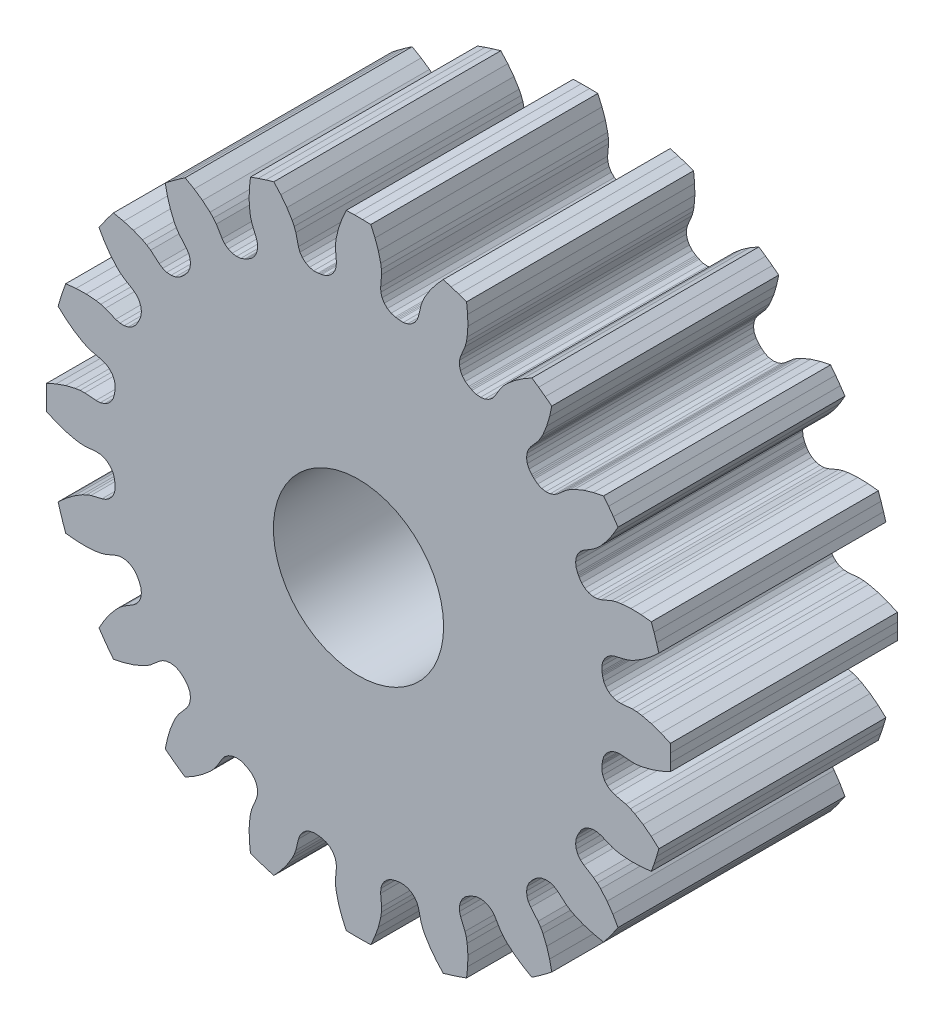
from build123d import *

# Parameters (mm, degrees)
EXTRUDE_1_DEPTH = 4.00000019
SKETCH_2_R      = 1.75
SKETCH_2_R_2    = 1.5
EXTRUDE_2_DEPTH = 4.00000019


with BuildPart() as part:
    # Эскиз1 → Бобышка-Вытянуть1 (new body)
    with BuildSketch(Plane.XY.offset(4.00000019)):
        Polygon((4.321288317, -0.574795646), (4.359403625, -0.509059406), (4.412631039, -0.454829365), (4.477644339, -0.415493647), (4.550382029, -0.393509952), (4.626299255, -0.390251807), (4.823635798, -0.406552339), (4.907172639, -0.403153826), (4.991217051, -0.391086418), (5.159787834, -0.35000444), (5.328199361, -0.290927448), (5.495740566, -0.216414497), (5.499526393, -0.072154726), (5.499526393, 0.072154726), (5.495740566, 0.216414497), (5.328199361, 0.290927448), (5.159787834, 0.35000444), (4.991217051, 0.391086418), (4.907172639, 0.403153826), (4.823635798, 0.406552339), (4.626299255, 0.390251807), (4.550382029, 0.393509952), (4.477644339, 0.415493647), (4.412631039, 0.454829365), (4.359403625, 0.509059406), (4.321288317, 0.574795646), (4.300666042, 0.647930894), (4.29735193, 0.669557718), (4.29392932, 0.691167545), (4.29039821, 0.712759851), (4.287410527, 0.78868831), (4.303347319, 0.862985558), (4.337211605, 0.931009534), (4.38688742, 0.988510321), (4.449271597, 1.031895168), (4.520467017, 1.058453578), (4.713181872, 1.103931223), (4.791580141, 1.132977777), (4.867781419, 1.170425559), (5.015407223, 1.26158807), (5.157320295, 1.369815785), (5.293635651, 1.492454787), (5.252657924, 1.630823943), (5.208063405, 1.768070506), (5.15988376, 1.904099714), (4.977517761, 1.923192642), (4.799092188, 1.927336096), (4.626077134, 1.914316206), (4.542416893, 1.899821917), (4.461918958, 1.877239672), (4.279277753, 1.800756669), (4.206069279, 1.780395629), (4.130098503, 1.778826118), (4.056111444, 1.796146389), (3.988731187, 1.83127413), (3.93216731, 1.88201468), (3.889954649, 1.945197699), (3.880119883, 1.964741852), (3.870186862, 1.984236529), (3.860156052, 2.003680682), (3.83385201, 2.074969932), (3.826049389, 2.150555374), (3.837235505, 2.225714736), (3.866711631, 2.295752056), (3.912635613, 2.356291283), (3.97213921, 2.403550083), (4.141368903, 2.506354125), (4.206954036, 2.558205277), (4.26785415, 2.617368242), (4.380083643, 2.749687759), (4.481607117, 2.89647188), (4.573352635, 3.055232344), (4.491622094, 3.174166195), (4.406798631, 3.29091493), (4.31894185, 3.405398456), (4.139601253, 3.367202356), (3.968628589, 3.316006623), (3.808104433, 3.250159323), (3.73301818, 3.210522234), (3.663437907, 3.164169844), (3.513370408, 3.034990747), (3.45003698, 2.993003931), (3.378269495, 2.968034707), (3.302551573, 2.961644204), (3.227614099, 2.974231029), (3.158139298, 3.005008912), (3.098467365, 3.052055137), (3.083074465, 3.067603568), (3.067603568, 3.083074465), (3.052055137, 3.098467365), (3.005008912, 3.158139298), (2.974231029, 3.227614099), (2.961644204, 3.302551573), (2.968034707, 3.378269495), (2.993003931, 3.45003698), (3.034990747, 3.513370408), (3.164169844, 3.663437907), (3.210522234, 3.73301818), (3.250159323, 3.808104433), (3.316006623, 3.968628589), (3.367202356, 4.139601253), (3.405398456, 4.31894185), (3.29091493, 4.406798631), (3.174166195, 4.491622094), (3.055232344, 4.573352635), (2.89647188, 4.481607117), (2.749687759, 4.380083643), (2.617368242, 4.26785415), (2.558205277, 4.206954036), (2.506354125, 4.141368903), (2.403550083, 3.97213921), (2.356291283, 3.912635613), (2.295752056, 3.866711631), (2.225714736, 3.837235505), (2.150555374, 3.826049389), (2.074969932, 3.83385201), (2.003680682, 3.860156052), (1.984236529, 3.870186862), (1.964741852, 3.880119883), (1.945197699, 3.889954649), (1.88201468, 3.93216731), (1.83127413, 3.988731187), (1.796146389, 4.056111444), (1.778826118, 4.130098503), (1.780395629, 4.206069279), (1.800756669, 4.279277753), (1.877239672, 4.461918958), (1.899821917, 4.542416893), (1.914316206, 4.626077134), (1.927336096, 4.799092188), (1.923192642, 4.977517761), (1.904099714, 5.15988376), (1.768070506, 5.208063405), (1.630823943, 5.252657924), (1.492454787, 5.293635651), (1.369815785, 5.157320295), (1.26158807, 5.015407223), (1.170425559, 4.867781419), (1.132977777, 4.791580141), (1.103931223, 4.713181872), (1.058453578, 4.520467017), (1.031895168, 4.449271597), (0.988510321, 4.38688742), (0.931009534, 4.337211605), (0.862985558, 4.303347319), (0.78868831, 4.287410527), (0.712759851, 4.29039821), (0.691167545, 4.29392932), (0.669557718, 4.29735193), (0.647930894, 4.300666042), (0.574795646, 4.321288317), (0.509059406, 4.359403625), (0.454829365, 4.412631039), (0.415493647, 4.477644339), (0.393509952, 4.550382029), (0.390251807, 4.626299255), (0.406552339, 4.823635798), (0.403153826, 4.907172639), (0.391086418, 4.991217051), (0.35000444, 5.159787834), (0.290927448, 5.328199361), (0.216414497, 5.495740566), (0.072154726, 5.499526393), (-0.072154726, 5.499526393), (-0.216414497, 5.495740566), (-0.290927448, 5.328199361), (-0.35000444, 5.159787834), (-0.391086418, 4.991217051), (-0.403153826, 4.907172639), (-0.406552339, 4.823635798), (-0.390251807, 4.626299255), (-0.393509952, 4.550382029), (-0.415493647, 4.477644339), (-0.454829365, 4.412631039), (-0.509059406, 4.359403625), (-0.574795646, 4.321288317), (-0.647930894, 4.300666042), (-0.669557718, 4.29735193), (-0.691167545, 4.29392932), (-0.712759851, 4.29039821), (-0.78868831, 4.287410527), (-0.862985558, 4.303347319), (-0.931009534, 4.337211605), (-0.988510321, 4.38688742), (-1.031895168, 4.449271597), (-1.058453578, 4.520467017), (-1.103931223, 4.713181872), (-1.132977777, 4.791580141), (-1.170425559, 4.867781419), (-1.26158807, 5.015407223), (-1.369815785, 5.157320295), (-1.492454787, 5.293635651), (-1.630823943, 5.252657924), (-1.768070506, 5.208063405), (-1.904099714, 5.15988376), (-1.923192642, 4.977517761), (-1.927336096, 4.799092188), (-1.914316206, 4.626077134), (-1.899821917, 4.542416893), (-1.877239672, 4.461918958), (-1.800756669, 4.279277753), (-1.780395629, 4.206069279), (-1.778826118, 4.130098503), (-1.796146389, 4.056111444), (-1.83127413, 3.988731187), (-1.88201468, 3.93216731), (-1.945197699, 3.889954649), (-1.964741852, 3.880119883), (-1.984236529, 3.870186862), (-2.003680682, 3.860156052), (-2.074969932, 3.83385201), (-2.150555374, 3.826049389), (-2.225714736, 3.837235505), (-2.295752056, 3.866711631), (-2.356291283, 3.912635613), (-2.403550083, 3.97213921), (-2.506354125, 4.141368903), (-2.558205277, 4.206954036), (-2.617368242, 4.26785415), (-2.749687759, 4.380083643), (-2.89647188, 4.481607117), (-3.055232344, 4.573352635), (-3.174166195, 4.491622094), (-3.29091493, 4.406798631), (-3.405398456, 4.31894185), (-3.367202356, 4.139601253), (-3.316006623, 3.968628589), (-3.250159323, 3.808104433), (-3.210522234, 3.73301818), (-3.164169844, 3.663437907), (-3.034990747, 3.513370408), (-2.993003931, 3.45003698), (-2.968034707, 3.378269495), (-2.961644204, 3.302551573), (-2.974231029, 3.227614099), (-3.005008912, 3.158139298), (-3.052055137, 3.098467365), (-3.067603568, 3.083074465), (-3.083074465, 3.067603568), (-3.098467365, 3.052055137), (-3.158139298, 3.005008912), (-3.227614099, 2.974231029), (-3.302551573, 2.961644204), (-3.378269495, 2.968034707), (-3.45003698, 2.993003931), (-3.513370408, 3.034990747), (-3.663437907, 3.164169844), (-3.73301818, 3.210522234), (-3.808104433, 3.250159323), (-3.968628589, 3.316006623), (-4.139601253, 3.367202356), (-4.31894185, 3.405398456), (-4.406798631, 3.29091493), (-4.491622094, 3.174166195), (-4.573352635, 3.055232344), (-4.481607117, 2.89647188), (-4.380083643, 2.749687759), (-4.26785415, 2.617368242), (-4.206954036, 2.558205277), (-4.141368903, 2.506354125), (-3.97213921, 2.403550083), (-3.912635613, 2.356291283), (-3.866711631, 2.295752056), (-3.837235505, 2.225714736), (-3.826049389, 2.150555374), (-3.83385201, 2.074969932), (-3.860156052, 2.003680682), (-3.870186862, 1.984236529), (-3.880119883, 1.964741852), (-3.889954649, 1.945197699), (-3.93216731, 1.88201468), (-3.988731187, 1.83127413), (-4.056111444, 1.796146389), (-4.130098503, 1.778826118), (-4.206069279, 1.780395629), (-4.279277753, 1.800756669), (-4.461918958, 1.877239672), (-4.542416893, 1.899821917), (-4.626077134, 1.914316206), (-4.799092188, 1.927336096), (-4.977517761, 1.923192642), (-5.15988376, 1.904099714), (-5.208063405, 1.768070506), (-5.252657924, 1.630823943), (-5.293635651, 1.492454787), (-5.157320295, 1.369815785), (-5.015407223, 1.26158807), (-4.867781419, 1.170425559), (-4.791580141, 1.132977777), (-4.713181872, 1.103931223), (-4.520467017, 1.058453578), (-4.449271597, 1.031895168), (-4.38688742, 0.988510321), (-4.337211605, 0.931009534), (-4.303347319, 0.862985558), (-4.287410527, 0.78868831), (-4.29039821, 0.712759851), (-4.29392932, 0.691167545), (-4.29735193, 0.669557718), (-4.300666042, 0.647930894), (-4.321288317, 0.574795646), (-4.359403625, 0.509059406), (-4.412631039, 0.454829365), (-4.477644339, 0.415493647), (-4.550382029, 0.393509952), (-4.626299255, 0.390251807), (-4.823635798, 0.406552339), (-4.907172639, 0.403153826), (-4.991217051, 0.391086418), (-5.159787834, 0.35000444), (-5.328199361, 0.290927448), (-5.495740566, 0.216414497), (-5.499526393, 0.072154726), (-5.499526393, -0.072154726), (-5.495740566, -0.216414497), (-5.328199361, -0.290927448), (-5.159787834, -0.35000444), (-4.991217051, -0.391086418), (-4.907172639, -0.403153826), (-4.823635798, -0.406552339), (-4.626299255, -0.390251807), (-4.550382029, -0.393509952), (-4.477644339, -0.415493647), (-4.412631039, -0.454829365), (-4.359403625, -0.509059406), (-4.321288317, -0.574795646), (-4.300666042, -0.647930894), (-4.29735193, -0.669557718), (-4.29392932, -0.691167545), (-4.29039821, -0.712759851), (-4.287410527, -0.78868831), (-4.303347319, -0.862985558), (-4.337211605, -0.931009534), (-4.38688742, -0.988510321), (-4.449271597, -1.031895168), (-4.520467017, -1.058453578), (-4.713181872, -1.103931223), (-4.791580141, -1.132977777), (-4.867781419, -1.170425559), (-5.015407223, -1.26158807), (-5.157320295, -1.369815785), (-5.293635651, -1.492454787), (-5.252657924, -1.630823943), (-5.208063405, -1.768070506), (-5.15988376, -1.904099714), (-4.977517761, -1.923192642), (-4.799092188, -1.927336096), (-4.626077134, -1.914316206), (-4.542416893, -1.899821917), (-4.461918958, -1.877239672), (-4.279277753, -1.800756669), (-4.206069279, -1.780395629), (-4.130098503, -1.778826118), (-4.056111444, -1.796146389), (-3.988731187, -1.83127413), (-3.93216731, -1.88201468), (-3.889954649, -1.945197699), (-3.880119883, -1.964741852), (-3.870186862, -1.984236529), (-3.860156052, -2.003680682), (-3.83385201, -2.074969932), (-3.826049389, -2.150555374), (-3.837235505, -2.225714736), (-3.866711631, -2.295752056), (-3.912635613, -2.356291283), (-3.97213921, -2.403550083), (-4.141368903, -2.506354125), (-4.206954036, -2.558205277), (-4.26785415, -2.617368242), (-4.380083643, -2.749687759), (-4.481607117, -2.89647188), (-4.573352635, -3.055232344), (-4.491622094, -3.174166195), (-4.406798631, -3.29091493), (-4.31894185, -3.405398456), (-4.139601253, -3.367202356), (-3.968628589, -3.316006623), (-3.808104433, -3.250159323), (-3.73301818, -3.210522234), (-3.663437907, -3.164169844), (-3.513370408, -3.034990747), (-3.45003698, -2.993003931), (-3.378269495, -2.968034707), (-3.302551573, -2.961644204), (-3.227614099, -2.974231029), (-3.158139298, -3.005008912), (-3.098467365, -3.052055137), (-3.083074465, -3.067603568), (-3.067603568, -3.083074465), (-3.052055137, -3.098467365), (-3.005008912, -3.158139298), (-2.974231029, -3.227614099), (-2.961644204, -3.302551573), (-2.968034707, -3.378269495), (-2.993003931, -3.45003698), (-3.034990747, -3.513370408), (-3.164169844, -3.663437907), (-3.210522234, -3.73301818), (-3.250159323, -3.808104433), (-3.316006623, -3.968628589), (-3.367202356, -4.139601253), (-3.405398456, -4.31894185), (-3.29091493, -4.406798631), (-3.174166195, -4.491622094), (-3.055232344, -4.573352635), (-2.89647188, -4.481607117), (-2.749687759, -4.380083643), (-2.617368242, -4.26785415), (-2.558205277, -4.206954036), (-2.506354125, -4.141368903), (-2.403550083, -3.97213921), (-2.356291283, -3.912635613), (-2.295752056, -3.866711631), (-2.225714736, -3.837235505), (-2.150555374, -3.826049389), (-2.074969932, -3.83385201), (-2.003680682, -3.860156052), (-1.984236529, -3.870186862), (-1.964741852, -3.880119883), (-1.945197699, -3.889954649), (-1.88201468, -3.93216731), (-1.83127413, -3.988731187), (-1.796146389, -4.056111444), (-1.778826118, -4.130098503), (-1.780395629, -4.206069279), (-1.800756669, -4.279277753), (-1.877239672, -4.461918958), (-1.899821917, -4.542416893), (-1.914316206, -4.626077134), (-1.927336096, -4.799092188), (-1.923192642, -4.977517761), (-1.904099714, -5.15988376), (-1.768070506, -5.208063405), (-1.630823943, -5.252657924), (-1.492454787, -5.293635651), (-1.369815785, -5.157320295), (-1.26158807, -5.015407223), (-1.170425559, -4.867781419), (-1.132977777, -4.791580141), (-1.103931223, -4.713181872), (-1.058453578, -4.520467017), (-1.031895168, -4.449271597), (-0.988510321, -4.38688742), (-0.931009534, -4.337211605), (-0.862985558, -4.303347319), (-0.78868831, -4.287410527), (-0.712759851, -4.29039821), (-0.691167545, -4.29392932), (-0.669557718, -4.29735193), (-0.647930894, -4.300666042), (-0.574795646, -4.321288317), (-0.509059406, -4.359403625), (-0.454829365, -4.412631039), (-0.415493647, -4.477644339), (-0.393509952, -4.550382029), (-0.390251807, -4.626299255), (-0.406552339, -4.823635798), (-0.403153826, -4.907172639), (-0.391086418, -4.991217051), (-0.35000444, -5.159787834), (-0.290927448, -5.328199361), (-0.216414497, -5.495740566), (-0.072154726, -5.499526393), (0.072154726, -5.499526393), (0.216414497, -5.495740566), (0.290927448, -5.328199361), (0.35000444, -5.159787834), (0.391086418, -4.991217051), (0.403153826, -4.907172639), (0.406552339, -4.823635798), (0.390251807, -4.626299255), (0.393509952, -4.550382029), (0.415493647, -4.477644339), (0.454829365, -4.412631039), (0.509059406, -4.359403625), (0.574795646, -4.321288317), (0.647930894, -4.300666042), (0.669557718, -4.29735193), (0.691167545, -4.29392932), (0.712759851, -4.29039821), (0.78868831, -4.287410527), (0.862985558, -4.303347319), (0.931009534, -4.337211605), (0.988510321, -4.38688742), (1.031895168, -4.449271597), (1.058453578, -4.520467017), (1.103931223, -4.713181872), (1.132977777, -4.791580141), (1.170425559, -4.867781419), (1.26158807, -5.015407223), (1.369815785, -5.157320295), (1.492454787, -5.293635651), (1.630823943, -5.252657924), (1.768070506, -5.208063405), (1.904099714, -5.15988376), (1.923192642, -4.977517761), (1.927336096, -4.799092188), (1.914316206, -4.626077134), (1.899821917, -4.542416893), (1.877239672, -4.461918958), (1.800756669, -4.279277753), (1.780395629, -4.206069279), (1.778826118, -4.130098503), (1.796146389, -4.056111444), (1.83127413, -3.988731187), (1.88201468, -3.93216731), (1.945197699, -3.889954649), (1.964741852, -3.880119883), (1.984236529, -3.870186862), (2.003680682, -3.860156052), (2.074969932, -3.83385201), (2.150555374, -3.826049389), (2.225714736, -3.837235505), (2.295752056, -3.866711631), (2.356291283, -3.912635613), (2.403550083, -3.97213921), (2.506354125, -4.141368903), (2.558205277, -4.206954036), (2.617368242, -4.26785415), (2.749687759, -4.380083643), (2.89647188, -4.481607117), (3.055232344, -4.573352635), (3.174166195, -4.491622094), (3.29091493, -4.406798631), (3.405398456, -4.31894185), (3.367202356, -4.139601253), (3.316006623, -3.968628589), (3.250159323, -3.808104433), (3.210522234, -3.73301818), (3.164169844, -3.663437907), (3.034990747, -3.513370408), (2.993003931, -3.45003698), (2.968034707, -3.378269495), (2.961644204, -3.302551573), (2.974231029, -3.227614099), (3.005008912, -3.158139298), (3.052055137, -3.098467365), (3.067603568, -3.083074465), (3.083074465, -3.067603568), (3.098467365, -3.052055137), (3.158139298, -3.005008912), (3.227614099, -2.974231029), (3.302551573, -2.961644204), (3.378269495, -2.968034707), (3.45003698, -2.993003931), (3.513370408, -3.034990747), (3.663437907, -3.164169844), (3.73301818, -3.210522234), (3.808104433, -3.250159323), (3.968628589, -3.316006623), (4.139601253, -3.367202356), (4.31894185, -3.405398456), (4.406798631, -3.29091493), (4.491622094, -3.174166195), (4.573352635, -3.055232344), (4.481607117, -2.89647188), (4.380083643, -2.749687759), (4.26785415, -2.617368242), (4.206954036, -2.558205277), (4.141368903, -2.506354125), (3.97213921, -2.403550083), (3.912635613, -2.356291283), (3.866711631, -2.295752056), (3.837235505, -2.225714736), (3.826049389, -2.150555374), (3.83385201, -2.074969932), (3.860156052, -2.003680682), (3.870186862, -1.984236529), (3.880119883, -1.964741852), (3.889954649, -1.945197699), (3.93216731, -1.88201468), (3.988731187, -1.83127413), (4.056111444, -1.796146389), (4.130098503, -1.778826118), (4.206069279, -1.780395629), (4.279277753, -1.800756669), (4.461918958, -1.877239672), (4.542416893, -1.899821917), (4.626077134, -1.914316206), (4.799092188, -1.927336096), (4.977517761, -1.923192642), (5.15988376, -1.904099714), (5.208063405, -1.768070506), (5.252657924, -1.630823943), (5.293635651, -1.492454787), (5.157320295, -1.369815785), (5.015407223, -1.26158807), (4.867781419, -1.170425559), (4.791580141, -1.132977777), (4.713181872, -1.103931223), (4.520467017, -1.058453578), (4.449271597, -1.031895168), (4.38688742, -0.988510321), (4.337211605, -0.931009534), (4.303347319, -0.862985558), (4.287410527, -0.78868831), (4.29039821, -0.712759851), (4.29392932, -0.691167545), (4.29735193, -0.669557718), (4.300666042, -0.647930894), align=None)
        Polygon((1.11369323, -1.11369323), (0.981996418, -1.23138458), (0.837950502, -1.333590597), (0.683366903, -1.419026055), (0.520189526, -1.486616209), (0.35047048, -1.535511459), (0.176344052, -1.565096783), (0, -1.575000002), (-0.176344052, -1.565096783), (-0.35047048, -1.535511459), (-0.520189526, -1.486616209), (-0.683366903, -1.419026055), (-0.837950502, -1.333590597), (-0.981996418, -1.23138458), (-1.11369323, -1.11369323), (-1.23138458, -0.981996418), (-1.333590597, -0.837950502), (-1.419026055, -0.683366903), (-1.486616209, -0.520189526), (-1.535511459, -0.35047048), (-1.565096783, -0.176344052), (-1.575000002, 0), (-1.565096783, 0.176344052), (-1.535511459, 0.35047048), (-1.486616209, 0.520189526), (-1.419026055, 0.683366903), (-1.333590597, 0.837950502), (-1.23138458, 0.981996418), (-1.11369323, 1.11369323), (-0.981996418, 1.23138458), (-0.837950502, 1.333590597), (-0.683366903, 1.419026055), (-0.520189526, 1.486616209), (-0.35047048, 1.535511459), (-0.176344052, 1.565096783), (0, 1.575000002), (0.176344052, 1.565096783), (0.35047048, 1.535511459), (0.520189526, 1.486616209), (0.683366903, 1.419026055), (0.837950502, 1.333590597), (0.981996418, 1.23138458), (1.11369323, 1.11369323), (1.23138458, 0.981996418), (1.333590597, 0.837950502), (1.419026055, 0.683366903), (1.486616209, 0.520189526), (1.535511459, 0.35047048), (1.565096783, 0.176344052), (1.575000002, 0), (1.565096783, -0.176344052), (1.535511459, -0.35047048), (1.486616209, -0.520189526), (1.419026055, -0.683366903), (1.333590597, -0.837950502), (1.23138458, -0.981996418), align=None, mode=Mode.SUBTRACT)
    extrude(amount=-EXTRUDE_1_DEPTH)

    # Эскиз2 → Бобышка-Вытянуть2 (add)
    with BuildSketch(Plane.XY.offset(4.00000019)):
        Circle(SKETCH_2_R)
        Circle(SKETCH_2_R_2, mode=Mode.SUBTRACT)
    extrude(amount=-EXTRUDE_2_DEPTH)


solid = part.part
